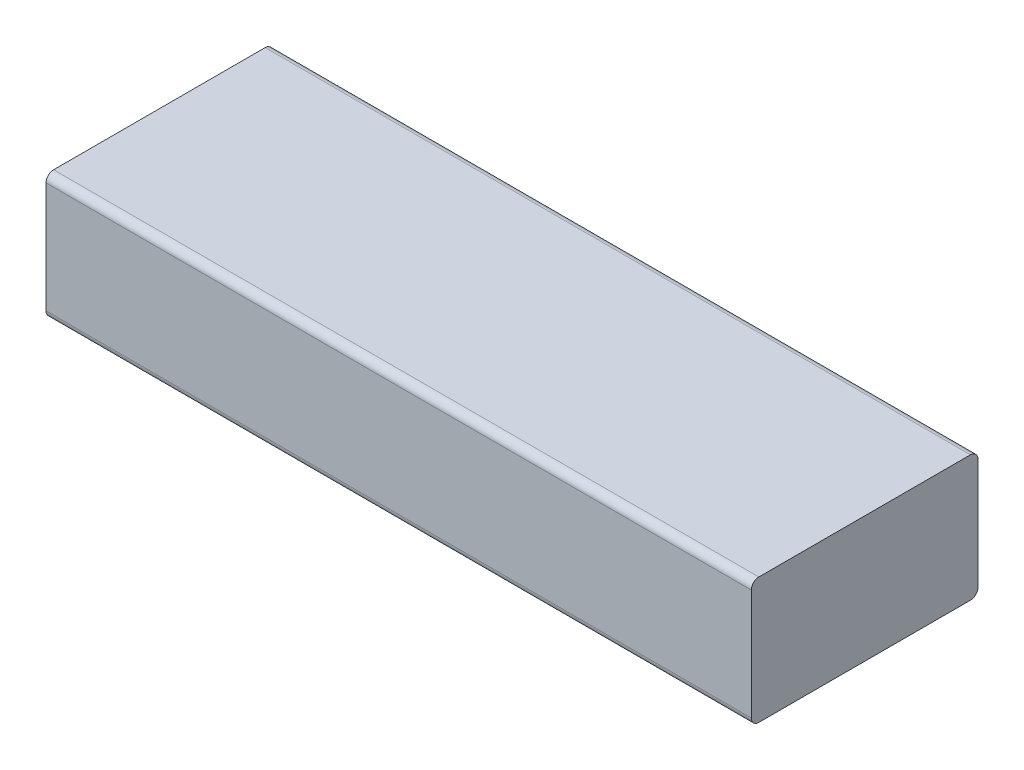
from build123d import *

# Parameters (mm, degrees)
BOSS_EXTRU_1_DEPTH = 25
CONG_1_R           = 1.5


with BuildPart() as part:
    # Esquisse2 → Boss.-Extru.1 (new body)
    with BuildSketch(Plane(origin=(0, 0, 0), x_dir=(1, 0, 0), z_dir=(0, 1, 0))):
        Polygon((0, 0), (70, 0), (70, 45), (-70, 45), (-70, 0), align=None)
    extrude(amount=BOSS_EXTRU_1_DEPTH)

    # Congé1
    cong_1_edges = [part.edges().sort_by_distance(p)[0] for p in [
        (0, 25, -45),
        (0, 25, 0),
        (0, 0, -45),
        (0, 0, 0),
    ]]
    fillet(cong_1_edges, radius=CONG_1_R)


solid = part.part
